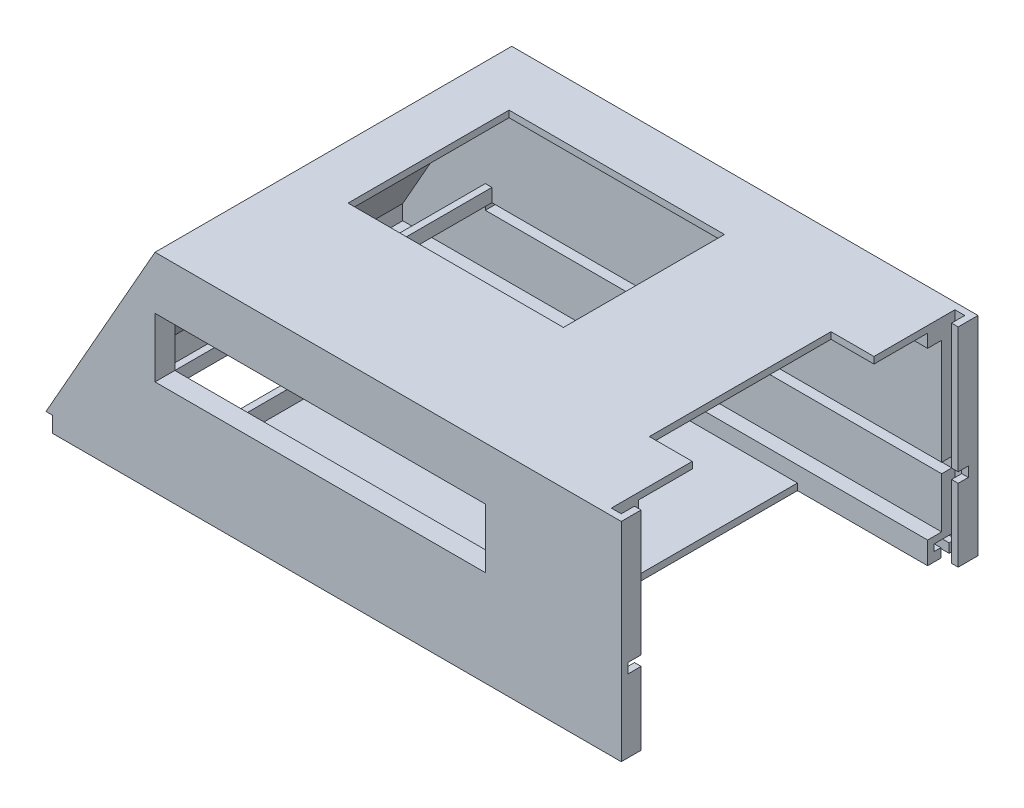
from build123d import *

# Parameters (mm, degrees)
SKETCH_1_W           = 174.15
SKETCH_1_H           = 108
EXTRUDE_1_DEPTH      = 63
CUT_EXTRUDE_2_DEPTH  = 174.15
CUT_EXTRUDE_3_REACH  = 122.279
SKETCH_6_W           = 2
SKETCH_6_H           = 108
SKETCH_7_W           = 96
SKETCH_7_H           = 50.25
CUT_EXTRUDE_5_DEPTH  = 168.15
SKETCH_8_W           = 87.5
SKETCH_8_H           = 4.75
CUT_EXTRUDE_6_DEPTH  = 168.15
SKETCH_10_W          = 168.15
SKETCH_10_H          = 87.5
CUT_EXTRUDE_8_DEPTH  = 59
SKETCH_12_W          = 168.15
SKETCH_12_H          = 96
EXTRUDE_2_DEPTH      = 2
SKETCH_15_W          = 25
SKETCH_15_H          = 70
SKETCH_15_W_2        = 55
SKETCH_15_H_2        = 20
SKETCH_15_W_3        = 44.398131355
SKETCH_15_H_3        = 87.5
CUT_EXTRUDE_9_DEPTH  = 2
SKETCH_16_W          = 25
SKETCH_16_H          = 96
SKETCH_16_W_2        = 32.283516817
CUT_EXTRUDE_10_DEPTH = 2
SKETCH_17_W          = 2
SKETCH_17_H          = 96
EXTRUDE_3_DEPTH      = 5
SKETCH_18_W          = 2
SKETCH_18_H          = 87.5
EXTRUDE_4_DEPTH      = 5
SKETCH_19_W          = 100
SKETCH_19_H          = 18
CUT_EXTRUDE_11_DEPTH = 6
CUT_EXTRUDE_12_REACH = 154.365
EXTRUDE_5_REACH      = 154.365
SKETCH_23_W          = 65.205598619
SKETCH_23_H          = 48.744694075
CUT_EXTRUDE_13_DEPTH = 2
CUT_EXTRUDE_START    = -63
CUT_EXTRUDE_14_DEPTH = 63
SKETCH_28_W          = 2
SKETCH_28_H          = 4.25
EXTRUDE_6_DEPTH      = 4.75
SKETCH_31_W          = 13
SKETCH_31_H          = 55
CUT_EXTRUDE_15_DEPTH = 10
SKETCH_34_W          = 103.070926165
SKETCH_34_H          = 3
CUT_EXTRUDE_16_DEPTH = 143.15


with BuildPart() as part:
    # 스케치1 → 보스-돌출1 (new body)
    with BuildSketch(Plane(origin=(0, 0, 0), x_dir=(1, 0, 0), z_dir=(0, 1, 0))):
        Rectangle(SKETCH_1_W, SKETCH_1_H)
    extrude(amount=EXTRUDE_1_DEPTH)

    # 스케치5 → 컷-돌출2 (cut)
    with BuildSketch(Plane.ZY.offset(87.075)):
        Polygon((-48, 0), (-47.75, 0), (-47.75, 2.75), (-45.75, 2.75), (-45.75, 4.75), (-52.25, 4.75), (-52.25, 2.75), (-50.25, 2.75), (-50.25, 0), (-50, 0), (-50, 3), (-52, 3), (-52, 4.5), (-46, 4.5), (-46, 3), (-48, 3), align=None)
        Polygon((-50, 0), (-48, 0), (-48, 3), (-46, 3), (-46, 4.5), (-52, 4.5), (-52, 3), (-50, 3), align=None)
        Polygon((50, 3), (50, 0), (50.25, 0), (50.25, 2.75), (52.25, 2.75), (52.25, 4.75), (45.75, 4.75), (45.75, 2.75), (47.75, 2.75), (47.75, 0), (48, 0), (48, 3), (46, 3), (46, 4.5), (52, 4.5), (52, 3), align=None)
        Polygon((48, 0), (50, 0), (50, 3), (52, 3), (52, 4.5), (46, 4.5), (46, 3), (48, 3), align=None)
    extrude(amount=-CUT_EXTRUDE_2_DEPTH, mode=Mode.SUBTRACT)

    # 컷-돌출3: up to this face of the body (flat: up to its plane)
    cut_extrude_3_end = Plane(part.part.faces().sort_by_distance((0, 4.75, 49))[0])
    # 스케치6 → 컷-돌출3 (cut, up to the picked face)
    with BuildSketch(Plane.XZ, mode=Mode.PRIVATE) as cut_extrude_3_sk1:
        with Locations((-86.075, 0)):
            Rectangle(SKETCH_6_W, SKETCH_6_H)
    cut_extrude_3_tool1 = split(extrude(cut_extrude_3_sk1.sketch, amount=-CUT_EXTRUDE_3_REACH, mode=Mode.PRIVATE), bisect_by=cut_extrude_3_end, keep=Keep.BOTH, mode=Mode.PRIVATE)
    add(cut_extrude_3_tool1.solids().sort_by(Axis((-86.075, 0, 0), (0, 1, 0)))[0], mode=Mode.SUBTRACT)

    # 스케치7 → 컷-돌출5 (cut)
    with BuildSketch(Plane(origin=(87.075, 0, 0), x_dir=(0, 0, -1), z_dir=(1, 0, 0))):
        with Locations((0, 31.875)):
            Rectangle(SKETCH_7_W, SKETCH_7_H)
    extrude(amount=-CUT_EXTRUDE_5_DEPTH, mode=Mode.SUBTRACT)

    # 스케치8 → 컷-돌출6 (cut)
    with BuildSketch(Plane(origin=(87.075, 0, 0), x_dir=(0, 0, -1), z_dir=(1, 0, 0))):
        with Locations((0, 4.375)):
            Rectangle(SKETCH_8_W, SKETCH_8_H)
    extrude(amount=-CUT_EXTRUDE_6_DEPTH, mode=Mode.SUBTRACT)

    # 스케치10 → 컷-돌출8 (cut)
    with BuildSketch(Plane(origin=(0, 2, 0), x_dir=(1, 0, 0), z_dir=(0, 1, 0))):
        with Locations((3, 0)):
            Rectangle(SKETCH_10_W, SKETCH_10_H)
    extrude(amount=CUT_EXTRUDE_8_DEPTH, mode=Mode.SUBTRACT)

    # 스케치12 → 보스-돌출2 (add)
    with BuildSketch(Plane(origin=(0, 24, 0), x_dir=(-1, 0, 0), z_dir=(0, -1, 0))):
        with Locations((-3, 0)):
            Rectangle(SKETCH_12_W, SKETCH_12_H)
    extrude(amount=EXTRUDE_2_DEPTH)

    # 스케치15 → 컷-돌출9 (cut)
    with BuildSketch(Plane(origin=(0, 2, 0), x_dir=(1, 0, 0), z_dir=(0, 1, 0))):
        with Locations((-68.575, 8.75)):
            Rectangle(SKETCH_15_W, SKETCH_15_H)
        with Locations((-9.233175572, -33.75)):
            Rectangle(SKETCH_15_W_2, SKETCH_15_H_2)
        with Locations((64.875934323, 0)):
            Rectangle(SKETCH_15_W_3, SKETCH_15_H_3)
    extrude(amount=-CUT_EXTRUDE_9_DEPTH, mode=Mode.SUBTRACT)

    # 스케치16 → 컷-돌출10 (cut)
    with BuildSketch(Plane(origin=(0, 24, 0), x_dir=(1, 0, 0), z_dir=(0, 1, 0))):
        with Locations((-68.575, 0)):
            Rectangle(SKETCH_16_W, SKETCH_16_H)
        with Locations((70.933241592, 0)):
            Rectangle(SKETCH_16_W_2, SKETCH_16_H)
    extrude(amount=-CUT_EXTRUDE_10_DEPTH, mode=Mode.SUBTRACT)

    # 스케치17 → 보스-돌출3 (add)
    with BuildSketch(Plane(origin=(0, 24, 0), x_dir=(1, 0, 0), z_dir=(0, 1, 0))):
        with Locations((-55.075, 0)):
            Rectangle(SKETCH_17_W, SKETCH_17_H)
    extrude(amount=EXTRUDE_3_DEPTH)

    # 스케치18 → 보스-돌출4 (add)
    with BuildSketch(Plane(origin=(0, 2, 0), x_dir=(1, 0, 0), z_dir=(0, 1, 0))):
        with Locations((-55.075, 0)):
            Rectangle(SKETCH_18_W, SKETCH_18_H)
    extrude(amount=EXTRUDE_4_DEPTH)

    # 스케치19 → 컷-돌출11 (cut)
    with BuildSketch(Plane(origin=(0, 0, 48), x_dir=(-1, 0, 0), z_dir=(0, 0, -1))):
        with Locations((4.075, 38)):
            Rectangle(SKETCH_19_W, SKETCH_19_H)
    extrude(amount=-CUT_EXTRUDE_11_DEPTH, mode=Mode.SUBTRACT)

    # 컷-돌출12: up to this face of the body (flat: up to its plane)
    cut_extrude_12_end = Plane(part.part.faces().sort_by_distance((0.074595533, 31.525240719, -54))[0])
    # 스케치20 → 컷-돌출12 (cut, up to the picked face)
    with BuildSketch(Plane.XY.offset(54), mode=Mode.PRIVATE) as cut_extrude_12_sk1:
        Polygon((-87.075, 4.75), (-54.075, 63), (-87.075, 63), align=None)
    cut_extrude_12_tool1 = split(extrude(cut_extrude_12_sk1.sketch, amount=-CUT_EXTRUDE_12_REACH, mode=Mode.PRIVATE), bisect_by=cut_extrude_12_end, keep=Keep.BOTH, mode=Mode.PRIVATE)
    add(cut_extrude_12_tool1.solids().sort_by(Axis((-76.075, 43.583333, 54), (0, 0, -1)))[0], mode=Mode.SUBTRACT)

    # 보스-돌출5: up to this face of the body (flat: up to its plane)
    extrude_5_end = Plane(part.part.faces().sort_by_distance((7.392919772, 30.366402897, -54))[0])
    # 스케치21 → 보스-돌출5 (add, up to the picked face)
    with BuildSketch(Plane.XY.offset(54), mode=Mode.PRIVATE) as extrude_5_sk1:
        Polygon((-87.075, 4.75), (-84.776349095, 4.75), (-51.776349095, 63), (-54.075, 63), align=None)
    extrude_5_tool1 = split(extrude(extrude_5_sk1.sketch, amount=-EXTRUDE_5_REACH, mode=Mode.PRIVATE), bisect_by=extrude_5_end, keep=Keep.BOTH, mode=Mode.PRIVATE)
    add(extrude_5_tool1.solids().sort_by(Axis((-69.425675, 33.875, 54), (0, 0, -1)))[0])

    # 스케치23 → 컷-돌출13 (cut)
    with BuildSketch(Plane(origin=(0, 63, 0), x_dir=(1, 0, 0), z_dir=(0, 1, 0))):
        with Locations((-5.140341164, 12.481591832)):
            Rectangle(SKETCH_23_W, SKETCH_23_H)
    extrude(amount=-CUT_EXTRUDE_13_DEPTH, mode=Mode.SUBTRACT)

    # 스케치26 → 컷-돌출14 (cut)
    with BuildSketch(Plane(origin=(0, 63, 0), x_dir=(1, 0, 0), z_dir=(0, 1, 0)).offset(CUT_EXTRUDE_START)):
        Polygon((82.075, 52), (85.075, 52), (85.075, 48), (87.075, 48), (87.075, -48), (85.075, -48), (85.075, -52), (82.075, -52), align=None)
    extrude(amount=CUT_EXTRUDE_14_DEPTH, mode=Mode.SUBTRACT)

    # 스케치28 → 보스-돌출6 (add)
    with BuildSketch(Plane.XZ.offset(-4.75)):
        with Locations((86.075, 50.125)):
            Rectangle(SKETCH_28_W, SKETCH_28_H)
        with Locations((86.075, -50.125)):
            Rectangle(SKETCH_28_W, SKETCH_28_H)
    extrude(amount=EXTRUDE_6_DEPTH)

    # 스케치31 → 컷-돌출15 (cut)
    with BuildSketch(Plane(origin=(0, 63, 0), x_dir=(1, 0, 0), z_dir=(0, 1, 0))):
        with Locations((75.575, 0)):
            Rectangle(SKETCH_31_W, SKETCH_31_H)
    extrude(amount=-CUT_EXTRUDE_15_DEPTH, mode=Mode.SUBTRACT)

    # 스케치34 → 컷-돌출16 (cut)
    with BuildSketch(Plane(origin=(87.075, 0, 0), x_dir=(0, 0, -1), z_dir=(1, 0, 0))):
        with Locations((-0.464536917, 23.5)):
            Rectangle(SKETCH_34_W, SKETCH_34_H)
    extrude(amount=-CUT_EXTRUDE_16_DEPTH, mode=Mode.SUBTRACT)


solid = part.part
